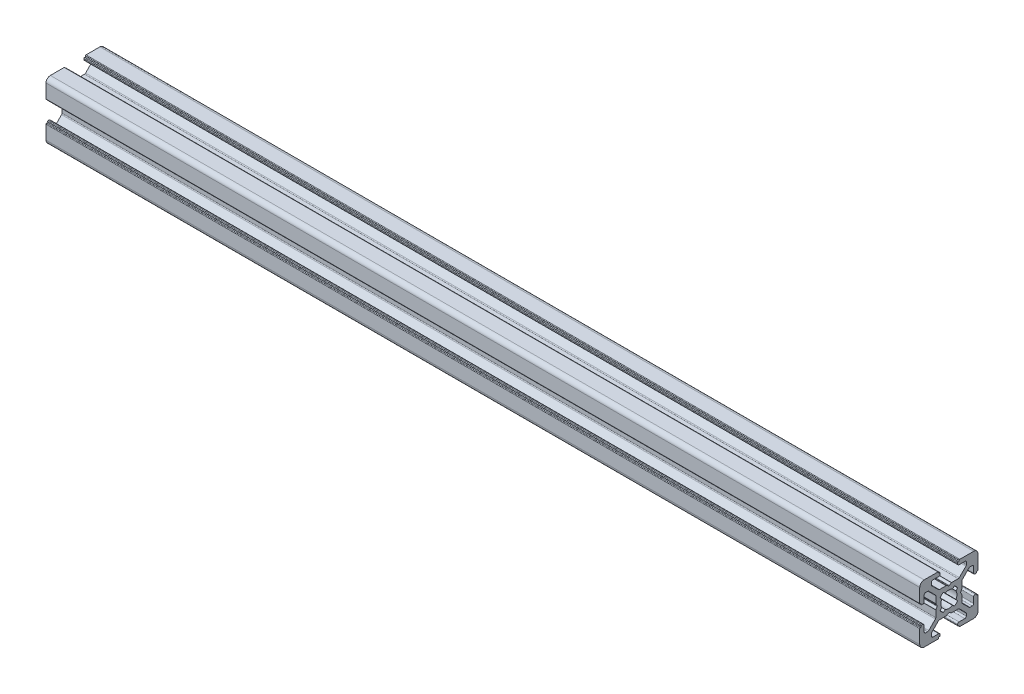
from build123d import *

# Parameters (mm, degrees)
METRIC_2020_1_DEPTH = 300


with BuildPart() as part:
    # Sketch11 → Metric 2020(1) (new body)
    with BuildSketch(Plane.YZ):
        with BuildLine():
            Line((-3.5, 8.499999673), (-5.500000686, 8.499999673))
            ThreePointArc((-5.500000686, 8.499999673), (-5.853554077, 8.353553064), (-6.000000686, 7.999999673))
            Line((-6.000000686, 7.999999673), (-6.000000686, 7.267766626))
            ThreePointArc((-6.000000686, 7.267766626), (-5.961940448, 7.076424899), (-5.853554059, 6.914213219))
            Line((-5.853554059, 6.914213219), (-3.585787212, 4.646446592))
            ThreePointArc((-3.585787212, 4.646446592), (-3.423575544, 4.538060229), (-3.232233839, 4.5))
            Line((-3.232233839, 4.5), (-0.953590312, 4.5))
            ThreePointArc((-0.953590312, 4.5), (-0.901826505, 4.493185166), (-0.853590316, 4.473205083))
            Line((-0.853590316, 4.473205083), (-0.100000045, 4.038119562))
            ThreePointArc((-0.100000045, 4.038119562), (0, 4.011324632), (0.100000045, 4.038119562))
            Line((0.100000045, 4.038119562), (0.853590316, 4.473205083))
            ThreePointArc((0.853590316, 4.473205083), (0.901826505, 4.493185166), (0.953590312, 4.5))
            Line((0.953590312, 4.5), (3.232233839, 4.5))
            ThreePointArc((3.232233839, 4.5), (3.423575544, 4.538060229), (3.585787212, 4.646446592))
            Line((3.585787212, 4.646446592), (5.853554059, 6.914213219))
            ThreePointArc((5.853554059, 6.914213219), (5.961940448, 7.076424899), (6.000000686, 7.267766626))
            Line((6.000000686, 7.267766626), (6.000000686, 7.999999673))
            ThreePointArc((6.000000686, 7.999999673), (5.853554077, 8.353553064), (5.500000686, 8.499999673))
            Line((5.500000686, 8.499999673), (3.5, 8.499999673))
            ThreePointArc((3.5, 8.499999673), (3.146446609, 8.646446283), (3, 8.999999673))
            Line((3, 8.999999673), (3, 9.3))
            ThreePointArc((3, 9.3), (3.058578644, 9.441421356), (3.2, 9.5))
            Line((3.2, 9.5), (3.350000228, 9.5))
            ThreePointArc((3.350000228, 9.5), (3.491421584, 9.558578644), (3.550000228, 9.7))
            Line((3.550000228, 9.7), (3.550000228, 9.8))
            ThreePointArc((3.550000228, 9.8), (3.608578871, 9.941421356), (3.750000228, 10))
            Line((3.750000228, 10), (8.5, 10))
            ThreePointArc((8.5, 10), (9.560660172, 9.560660172), (10, 8.5))
            Line((10, 8.5), (10, 3.749999605))
            ThreePointArc((10, 3.749999605), (9.941421356, 3.608578248), (9.8, 3.549999605))
            Line((9.8, 3.549999605), (9.699999732, 3.549999605))
            ThreePointArc((9.699999732, 3.549999605), (9.558578376, 3.491420961), (9.499999732, 3.349999605))
            Line((9.499999732, 3.349999605), (9.499999732, 3.2))
            ThreePointArc((9.499999732, 3.2), (9.441421088, 3.058578644), (9.299999732, 3))
            Line((9.299999732, 3), (8.999999732, 3))
            ThreePointArc((8.999999732, 3), (8.646446341, 3.146446609), (8.499999732, 3.5))
            Line((8.499999732, 3.5), (8.499999732, 5.499999605))
            ThreePointArc((8.499999732, 5.499999605), (8.353553123, 5.853552995), (7.999999732, 5.999999605))
            Line((7.999999732, 5.999999605), (7.267766685, 5.999999605))
            ThreePointArc((7.267766685, 5.999999605), (7.076424969, 5.961939371), (6.914213294, 5.853552995))
            Line((6.914213294, 5.853552995), (4.646446398, 3.585786099))
            ThreePointArc((4.646446398, 3.585786099), (4.538060023, 3.423574425), (4.499999789, 3.232232708))
            Line((4.499999789, 3.232232708), (4.499999789, 0.953589302))
            ThreePointArc((4.499999789, 0.953589302), (4.493184953, 0.90182549), (4.473204867, 0.853589297))
            Line((4.473204867, 0.853589297), (4.038119841, 0.099999969))
            ThreePointArc((4.038119841, 0.099999969), (4.011324929, 0), (4.038119841, -0.099999969))
            Line((4.038119841, -0.099999969), (4.473204867, -0.853589297))
            ThreePointArc((4.473204867, -0.853589297), (4.493184953, -0.90182549), (4.499999789, -0.953589302))
            Line((4.499999789, -0.953589302), (4.499999789, -3.232232708))
            ThreePointArc((4.499999789, -3.232232708), (4.538060023, -3.423574425), (4.646446398, -3.585786099))
            Line((4.646446398, -3.585786099), (6.914213294, -5.853552995))
            ThreePointArc((6.914213294, -5.853552995), (7.076424969, -5.961939371), (7.267766685, -5.999999605))
            Line((7.267766685, -5.999999605), (7.999999732, -5.999999605))
            ThreePointArc((7.999999732, -5.999999605), (8.353553123, -5.853552995), (8.499999732, -5.499999605))
            Line((8.499999732, -5.499999605), (8.499999732, -3.5))
            ThreePointArc((8.499999732, -3.5), (8.646446341, -3.146446609), (8.999999732, -3))
            Line((8.999999732, -3), (9.299999732, -3))
            ThreePointArc((9.299999732, -3), (9.441421088, -3.058578644), (9.499999732, -3.2))
            Line((9.499999732, -3.2), (9.499999732, -3.349999605))
            ThreePointArc((9.499999732, -3.349999605), (9.558578376, -3.491420961), (9.699999732, -3.549999605))
            Line((9.699999732, -3.549999605), (9.8, -3.549999605))
            ThreePointArc((9.8, -3.549999605), (9.941421356, -3.608578248), (10, -3.749999605))
            Line((10, -3.749999605), (10, -8.5))
            ThreePointArc((10, -8.5), (9.560660172, -9.560660172), (8.5, -10))
            Line((8.5, -10), (3.750000228, -10))
            ThreePointArc((3.750000228, -10), (3.608578871, -9.941421356), (3.550000228, -9.8))
            Line((3.550000228, -9.8), (3.550000228, -9.7))
            ThreePointArc((3.550000228, -9.7), (3.491421584, -9.558578644), (3.350000228, -9.5))
            Line((3.350000228, -9.5), (3.2, -9.5))
            ThreePointArc((3.2, -9.5), (3.058578644, -9.441421356), (3, -9.3))
            Line((3, -9.3), (3, -8.999999673))
            ThreePointArc((3, -8.999999673), (3.146446609, -8.646446283), (3.5, -8.499999673))
            Line((3.5, -8.499999673), (5.500000686, -8.499999673))
            ThreePointArc((5.500000686, -8.499999673), (5.853554077, -8.353553064), (6.000000686, -7.999999673))
            Line((6.000000686, -7.999999673), (6.000000686, -7.267766626))
            ThreePointArc((6.000000686, -7.267766626), (5.961940448, -7.076424899), (5.853554059, -6.914213219))
            Line((5.853554059, -6.914213219), (3.585787212, -4.646446592))
            ThreePointArc((3.585787212, -4.646446592), (3.423575544, -4.538060229), (3.232233839, -4.5))
            Line((3.232233839, -4.5), (0.953590312, -4.5))
            ThreePointArc((0.953590312, -4.5), (0.901826505, -4.493185166), (0.853590316, -4.473205083))
            Line((0.853590316, -4.473205083), (0.100000045, -4.038119562))
            ThreePointArc((0.100000045, -4.038119562), (0, -4.011324632), (-0.100000045, -4.038119562))
            Line((-0.100000045, -4.038119562), (-0.853590316, -4.473205083))
            ThreePointArc((-0.853590316, -4.473205083), (-0.901826505, -4.493185166), (-0.953590312, -4.5))
            Line((-0.953590312, -4.5), (-3.232233839, -4.5))
            ThreePointArc((-3.232233839, -4.5), (-3.423575544, -4.538060229), (-3.585787212, -4.646446592))
            Line((-3.585787212, -4.646446592), (-5.853554059, -6.914213219))
            ThreePointArc((-5.853554059, -6.914213219), (-5.961940448, -7.076424899), (-6.000000686, -7.267766626))
            Line((-6.000000686, -7.267766626), (-6.000000686, -7.999999673))
            ThreePointArc((-6.000000686, -7.999999673), (-5.853554077, -8.353553064), (-5.500000686, -8.499999673))
            Line((-5.500000686, -8.499999673), (-3.5, -8.499999673))
            ThreePointArc((-3.5, -8.499999673), (-3.146446609, -8.646446283), (-3, -8.999999673))
            Line((-3, -8.999999673), (-3, -9.3))
            ThreePointArc((-3, -9.3), (-3.058578644, -9.441421356), (-3.2, -9.5))
            Line((-3.2, -9.5), (-3.350000228, -9.5))
            ThreePointArc((-3.350000228, -9.5), (-3.491421584, -9.558578644), (-3.550000228, -9.7))
            Line((-3.550000228, -9.7), (-3.550000228, -9.8))
            ThreePointArc((-3.550000228, -9.8), (-3.608578871, -9.941421356), (-3.750000228, -10))
            Line((-3.750000228, -10), (-8.5, -10))
            ThreePointArc((-8.5, -10), (-9.560660172, -9.560660172), (-10, -8.5))
            Line((-10, -8.5), (-10, -3.749999605))
            ThreePointArc((-10, -3.749999605), (-9.941421356, -3.608578248), (-9.8, -3.549999605))
            Line((-9.8, -3.549999605), (-9.699999732, -3.549999605))
            ThreePointArc((-9.699999732, -3.549999605), (-9.558578376, -3.491420961), (-9.499999732, -3.349999605))
            Line((-9.499999732, -3.349999605), (-9.499999732, -3.2))
            ThreePointArc((-9.499999732, -3.2), (-9.441421088, -3.058578644), (-9.299999732, -3))
            Line((-9.299999732, -3), (-8.999999732, -3))
            ThreePointArc((-8.999999732, -3), (-8.646446341, -3.146446609), (-8.499999732, -3.5))
            Line((-8.499999732, -3.5), (-8.499999732, -5.499999605))
            ThreePointArc((-8.499999732, -5.499999605), (-8.353553123, -5.853552995), (-7.999999732, -5.999999605))
            Line((-7.999999732, -5.999999605), (-7.267766685, -5.999999605))
            ThreePointArc((-7.267766685, -5.999999605), (-7.076424969, -5.961939371), (-6.914213294, -5.853552995))
            Line((-6.914213294, -5.853552995), (-4.646446398, -3.585786099))
            ThreePointArc((-4.646446398, -3.585786099), (-4.538060023, -3.423574425), (-4.499999789, -3.232232708))
            Line((-4.499999789, -3.232232708), (-4.499999789, -0.953589302))
            ThreePointArc((-4.499999789, -0.953589302), (-4.493184953, -0.90182549), (-4.473204867, -0.853589297))
            Line((-4.473204867, -0.853589297), (-4.038119841, -0.099999969))
            ThreePointArc((-4.038119841, -0.099999969), (-4.011324929, 0), (-4.038119841, 0.099999969))
            Line((-4.038119841, 0.099999969), (-4.473204867, 0.853589297))
            ThreePointArc((-4.473204867, 0.853589297), (-4.493184953, 0.90182549), (-4.499999789, 0.953589302))
            Line((-4.499999789, 0.953589302), (-4.499999789, 3.232232708))
            ThreePointArc((-4.499999789, 3.232232708), (-4.538060023, 3.423574425), (-4.646446398, 3.585786099))
            Line((-4.646446398, 3.585786099), (-6.914213294, 5.853552995))
            ThreePointArc((-6.914213294, 5.853552995), (-7.076424969, 5.961939371), (-7.267766685, 5.999999605))
            Line((-7.267766685, 5.999999605), (-7.999999732, 5.999999605))
            ThreePointArc((-7.999999732, 5.999999605), (-8.353553123, 5.853552995), (-8.499999732, 5.499999605))
            Line((-8.499999732, 5.499999605), (-8.499999732, 3.5))
            ThreePointArc((-8.499999732, 3.5), (-8.646446341, 3.146446609), (-8.999999732, 3))
            Line((-8.999999732, 3), (-9.299999732, 3))
            ThreePointArc((-9.299999732, 3), (-9.441421088, 3.058578644), (-9.499999732, 3.2))
            Line((-9.499999732, 3.2), (-9.499999732, 3.349999605))
            ThreePointArc((-9.499999732, 3.349999605), (-9.558578376, 3.491420961), (-9.699999732, 3.549999605))
            Line((-9.699999732, 3.549999605), (-9.8, 3.549999605))
            ThreePointArc((-9.8, 3.549999605), (-9.941421356, 3.608578248), (-10, 3.749999605))
            Line((-10, 3.749999605), (-10, 8.5))
            ThreePointArc((-10, 8.5), (-9.560660172, 9.560660172), (-8.5, 10))
            Line((-8.5, 10), (-3.750000228, 10))
            ThreePointArc((-3.750000228, 10), (-3.608578871, 9.941421356), (-3.550000228, 9.8))
            Line((-3.550000228, 9.8), (-3.550000228, 9.7))
            ThreePointArc((-3.550000228, 9.7), (-3.491421584, 9.558578644), (-3.350000228, 9.5))
            Line((-3.350000228, 9.5), (-3.2, 9.5))
            ThreePointArc((-3.2, 9.5), (-3.058578644, 9.441421356), (-3, 9.3))
            Line((-3, 9.3), (-3, 8.999999673))
            ThreePointArc((-3, 8.999999673), (-3.146446609, 8.646446283), (-3.5, 8.499999673))
        make_face()
        with BuildLine():
            Line((-1.258185436, 2.445295362), (-1.91389502, 2.989640962))
            ThreePointArc((-1.91389502, 2.989640962), (-2.511737261, 2.508410485), (-2.992174953, 1.909930962))
            Line((-2.992174953, 1.909930962), (-2.445295423, 1.258185317))
            ThreePointArc((-2.445295423, 1.258185317), (-2.75, 0), (-2.445295423, -1.258185317))
            Line((-2.445295423, -1.258185317), (-2.992174953, -1.909930962))
            ThreePointArc((-2.992174953, -1.909930962), (-2.511737261, -2.508410485), (-1.91389502, -2.989640962))
            Line((-1.91389502, -2.989640962), (-1.258185436, -2.445295362))
            ThreePointArc((-1.258185436, -2.445295362), (0, -2.75), (1.258185436, -2.445295362))
            Line((1.258185436, -2.445295362), (1.91389502, -2.989640962))
            ThreePointArc((1.91389502, -2.989640962), (2.511737261, -2.508410485), (2.992174953, -1.909930962))
            Line((2.992174953, -1.909930962), (2.445295423, -1.258185317))
            ThreePointArc((2.445295423, -1.258185317), (2.75, 0), (2.445295423, 1.258185317))
            Line((2.445295423, 1.258185317), (2.992174953, 1.909930962))
            ThreePointArc((2.992174953, 1.909930962), (2.511737261, 2.508410485), (1.91389502, 2.989640962))
            Line((1.91389502, 2.989640962), (1.258185436, 2.445295362))
            ThreePointArc((1.258185436, 2.445295362), (0, 2.75), (-1.258185436, 2.445295362))
        make_face(mode=Mode.SUBTRACT)
    extrude(amount=METRIC_2020_1_DEPTH)


solid = part.part
